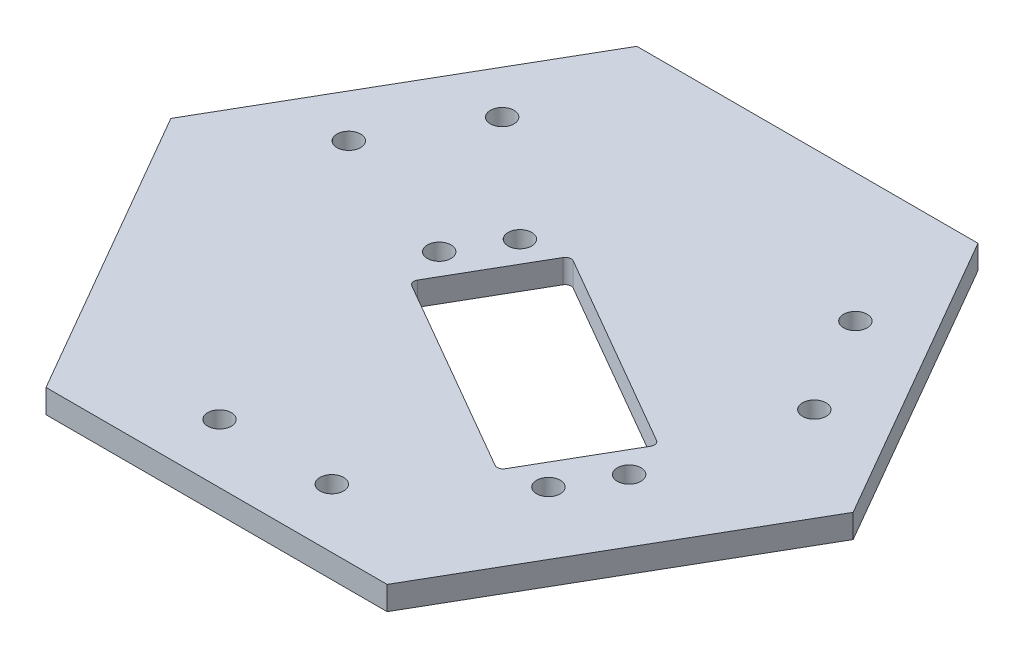
from build123d import *

# Parameters (mm, degrees)
SKETCH1_R           = 2
BOSS_EXTRUDE1_DEPTH = 2
SKETCH3_R           = 2
CUT_EXTRUDE1_DEPTH  = 10
FILLET1_R           = 1


with BuildPart() as part:
    # Sketch1 → Boss-Extrude1 (new, symmetric)
    with BuildSketch(Plane(origin=(0, 0, 0), x_dir=(1, 0, 0), z_dir=(0, 1, 0))):
        Polygon((-28.867513459, 50), (-57.735026919, 0), (-28.867513459, -50), (28.867513459, -50), (57.735026919, 0), (28.867513459, 50), align=None)
        with Locations(Location((29.891016151, 28.227241336, 0), (0, 0, 270))):
            Circle(SKETCH1_R, mode=Mode.SUBTRACT)
        with Locations(Location((39.391016151, 11.772758664, 0), (0, 0, 270))):
            Circle(SKETCH1_R, mode=Mode.SUBTRACT)
        with Locations(Location((-9.5, -40, 0), (0, 0, 270))):
            Circle(SKETCH1_R, mode=Mode.SUBTRACT)
        with Locations(Location((9.5, -40, 0), (0, 0, 270))):
            Circle(SKETCH1_R, mode=Mode.SUBTRACT)
        with Locations(Location((-39.391016151, 11.772758664, 0), (0, 0, 90))):
            Circle(SKETCH1_R, mode=Mode.SUBTRACT)
        with Locations(Location((-29.891016151, 28.227241336, 0), (0, 0, 90))):
            Circle(SKETCH1_R, mode=Mode.SUBTRACT)
    extrude(amount=BOSS_EXTRUDE1_DEPTH, both=True)

    # Sketch3 → Cut-Extrude1 (cut)
    with BuildSketch(Plane(origin=(0, 2, 0), x_dir=(1, 0, 0), z_dir=(0, 1, 0))):
        with Locations(Location((-10.490381057, 11.830127019, 0), (0, 0, 270))):
            Circle(SKETCH3_R)
        with Locations(Location((33.243901834, -13.419872981, 0), (0, 0, 270))):
            Circle(SKETCH3_R)
        with Locations(Location((28.243901834, -22.080127019, 0), (0, 0, 270))):
            Circle(SKETCH3_R)
        with Locations(Location((-15.490381057, 3.169872981, 0), (0, 0, 270))):
            Circle(SKETCH3_R)
        Polygon((-13.660254038, -3.660254038), (-3.660254038, 13.660254038), (31.413774815, -6.589745962), (21.413774815, -23.910254038), align=None)
    extrude(amount=-CUT_EXTRUDE1_DEPTH, mode=Mode.SUBTRACT)

    # Fillet1
    fillet1_edges = [part.edges().sort_by_distance(p)[0] for p in [
        (21.413774815, 0, 23.910254038),
        (-13.660254038, 0, 3.660254038),
        (-3.660254038, 0, -13.660254038),
        (31.413774815, 0, 6.589745962),
    ]]
    fillet(fillet1_edges, radius=FILLET1_R)


solid = part.part
